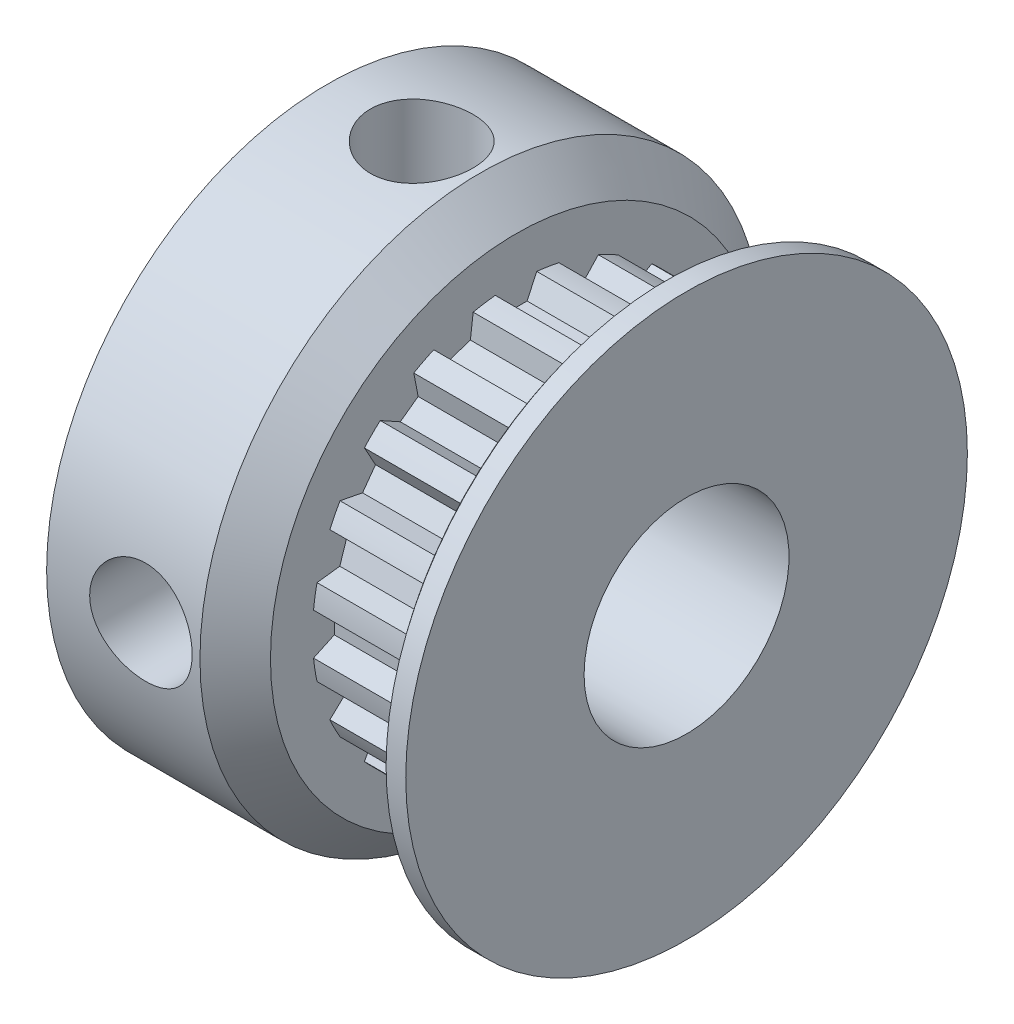
from build123d import *

# Parameters (mm, degrees)
SKETCH4_R          = 6.4643
SKETCH4_R_2        = 6.30555
CUT_EXTRUDE2_DEPTH = 4.064
CUT_EXTRUDE1_DEPTH = 4.064
CIRPATTERN1_COUNT  = 20
SKETCH6_R          = 1.5875
CUT_EXTRUDE3_DEPTH = 14.5020413
CIRPATTERN2_COUNT  = 2
CIRPATTERN2_ANGLE  = 90


with BuildPart() as part:
    # Sketch1 → Revolve1 (revolve)
    with BuildSketch(Plane.XY, mode=Mode.PRIVATE) as revolve1_sk:
        with BuildLine():
            Line((-5.5626, 3.175), (5.5626, 3.175))
            Line((5.5626, 3.175), (5.5626, 8.6995))
            Line((5.5626, 8.6995), (4.953, 8.6995))
            ThreePointArc((4.953, 8.6995), (4.500598199, 7.921733103), (4.3434, 7.0358))
            Line((4.3434, 7.0358), (4.3434, 6.4643))
            Line((4.3434, 6.4643), (0.2794, 6.4643))
            Line((0.2794, 6.4643), (0.2794, 7.6073))
            Line((0.2794, 7.6073), (-0.8128, 8.6995))
            Line((-0.8128, 8.6995), (-5.5626, 8.6995))
            Line((-5.5626, 8.6995), (-5.5626, 3.175))
        make_face()
    revolve(revolve1_sk.sketch.rotate(Axis((-5.5626, 0, 0), (1, 0, 0)), 90), axis=Axis((-5.5626, 0, 0), (1, 0, 0)))

    # Sketch4 → Cut-Extrude2 (cut)
    with BuildSketch(Plane(origin=(0.2794, 0, 0), x_dir=(0, 0, -1), z_dir=(1, 0, 0))):
        Circle(SKETCH4_R)
        Circle(SKETCH4_R_2, mode=Mode.SUBTRACT)
    extrude(amount=CUT_EXTRUDE2_DEPTH, mode=Mode.SUBTRACT)

    # Sketch3 → Cut-Extrude1 (cut)
    with BuildSketch(Plane(origin=(0.2794, 0, 0), x_dir=(0, 0, -1), z_dir=(1, 0, 0))):
        with BuildLine():
            Line((-0.642631898, 6.272717517), (-0.342185353, 5.628407823))
            Line((-0.342185353, 5.628407823), (0.342185353, 5.628407823))
            Line((0.342185353, 5.628407823), (0.642631898, 6.272717517))
            ThreePointArc((0.642631898, 6.272717517), (0, 6.30555), (-0.642631898, 6.272717517))
        make_face()
    cut_extrude1 = extrude(amount=CUT_EXTRUDE1_DEPTH, mode=Mode.SUBTRACT)

    # CirPattern1: Cut-Extrude1 ×20 about axis
    cirpattern1_axis = Axis((0, 0, 0), (1, 0, 0))
    for i in range(1, CIRPATTERN1_COUNT):
        add(cut_extrude1.rotate(cirpattern1_axis, i * 360 / CIRPATTERN1_COUNT), mode=Mode.SUBTRACT)

    # Sketch6 → Cut-Extrude3 (cut, through all)
    with BuildSketch(Plane(origin=(0, 0, 0), x_dir=(1, 0, 0), z_dir=(0, 1, 0))):
        with Locations(Location((-2.6416, 0, 0), (0, 0, 90))):
            Circle(SKETCH6_R)
    cut_extrude3 = extrude(amount=CUT_EXTRUDE3_DEPTH, mode=Mode.SUBTRACT)

    # CirPattern2: Cut-Extrude3 ×2 about axis
    cirpattern2_axis = Axis((-5.5626, 0, 0), (1, 0, 0))
    for i in range(1, CIRPATTERN2_COUNT):
        add(cut_extrude3.rotate(cirpattern2_axis, i * CIRPATTERN2_ANGLE / (CIRPATTERN2_COUNT - 1)), mode=Mode.SUBTRACT)


solid = part.part
